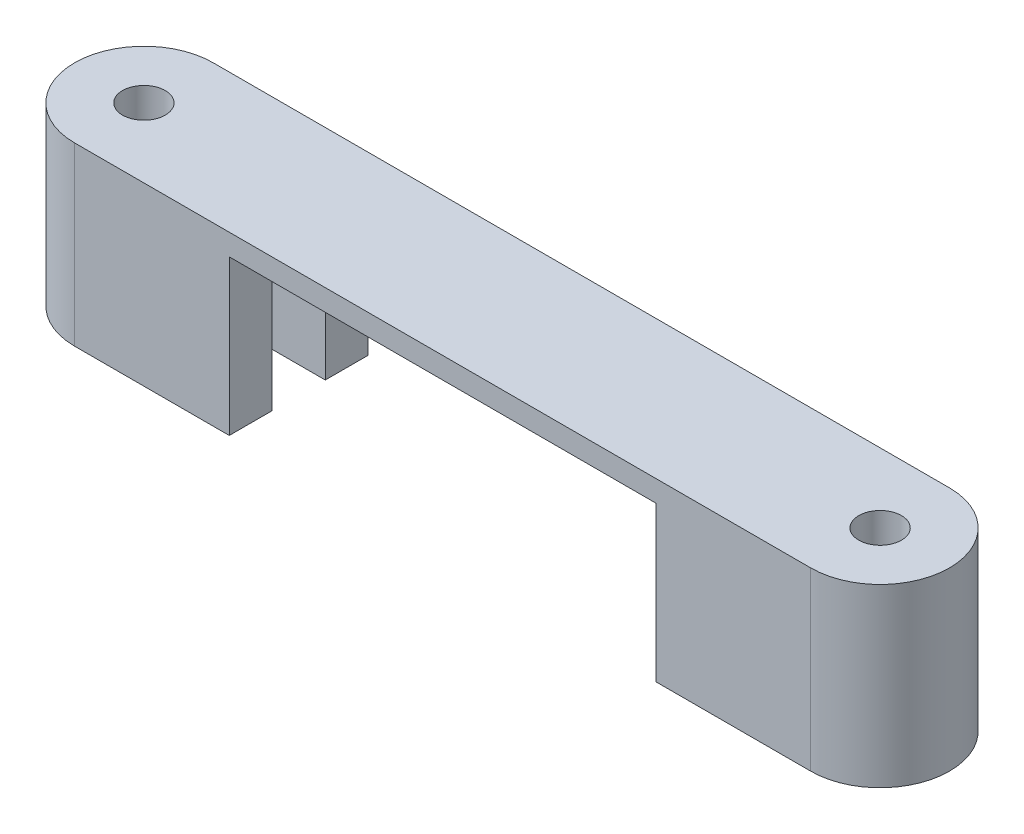
from build123d import *

# Parameters (mm, degrees)
BOSS_EXTRU_1_DEPTH      = 16.5
ESQUISSE2_R             = 2
ENL_V_MAT_EXTRU_1_DEPTH = 22
ENL_V_MAT_EXTRU_2_DEPTH = 14.5


with BuildPart() as part:
    # Esquisse1 → Boss.-Extru.1 (new body)
    with BuildSketch(Plane(origin=(0, 0, 0), x_dir=(1, 0, 0), z_dir=(0, 1, 0))):
        with BuildLine():
            Line((0, 0), (69, 0))
            ThreePointArc((69, 0), (75.5, 6.5), (69, 13))
            Line((69, 13), (0, 13))
            ThreePointArc((0, 13), (-6.5, 6.5), (0, 0))
        make_face()
    extrude(amount=BOSS_EXTRU_1_DEPTH)

    # Esquisse2 → Enlèv. mat.-Extru.1 (cut)
    with BuildSketch(Plane(origin=(0, 16.5, 0), x_dir=(1, 0, 0), z_dir=(0, 1, 0))):
        with Locations(Location((0, 6.5, 0), (0, 0, 270))):
            Circle(ESQUISSE2_R)
        with Locations(Location((69, 6.5, 0), (0, 0, 270))):
            Circle(ESQUISSE2_R)
    extrude(amount=-ENL_V_MAT_EXTRU_1_DEPTH, mode=Mode.SUBTRACT)

    # Esquisse3 → Enlèv. mat.-Extru.2 (cut)
    with BuildSketch(Plane(origin=(0, 0, 0), x_dir=(-1, 0, 0), z_dir=(0, -1, 0))):
        Polygon((-54.5, 13), (-54.5, 9), (-62.5, 9), (-62.5, 4), (-54.5, 4), (-54.5, 0), (-14.5, 0), (-14.5, 4), (-6.5, 4), (-6.5, 9), (-14.5, 9), (-14.5, 13), align=None)
    extrude(amount=-ENL_V_MAT_EXTRU_2_DEPTH, mode=Mode.SUBTRACT)


solid = part.part
